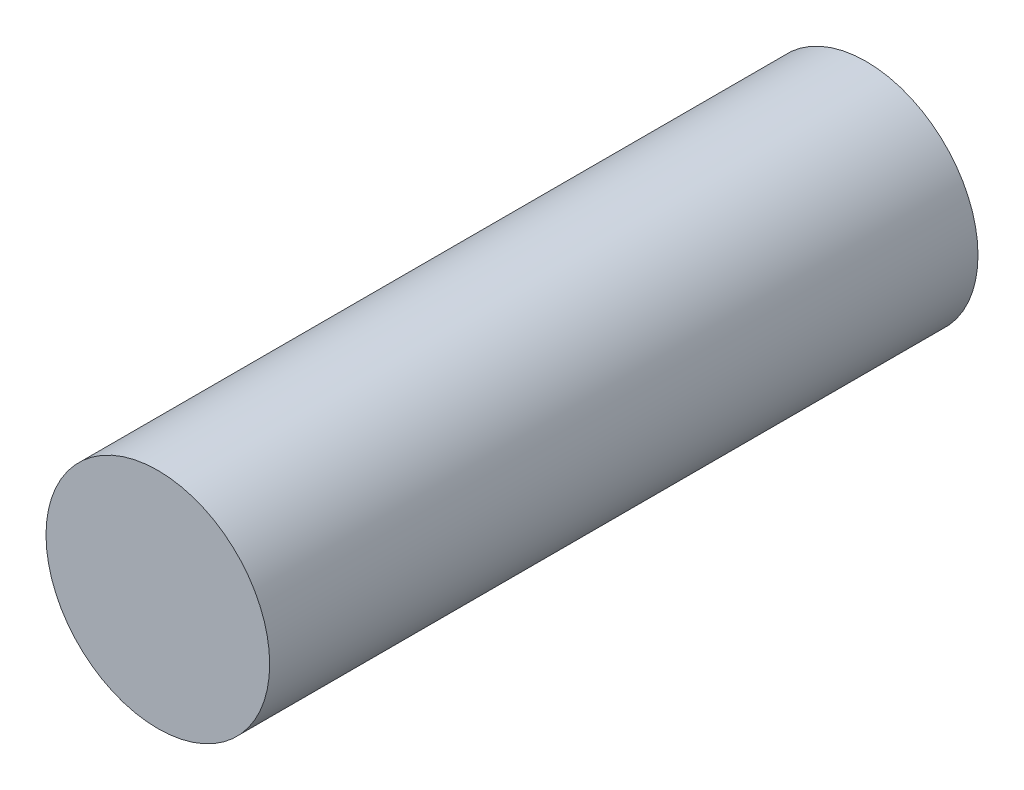
from build123d import *

# Parameters (mm, degrees)
SKETCH2_R           = 30
BOSS_EXTRUDE1_DEPTH = 190


with BuildPart() as part:
    # Sketch2 → Boss-Extrude1 (new body)
    with BuildSketch(Plane.XY):
        with Locations((-54.571604591, 30.034012599)):
            Circle(SKETCH2_R)
    extrude(amount=BOSS_EXTRUDE1_DEPTH)


solid = part.part
